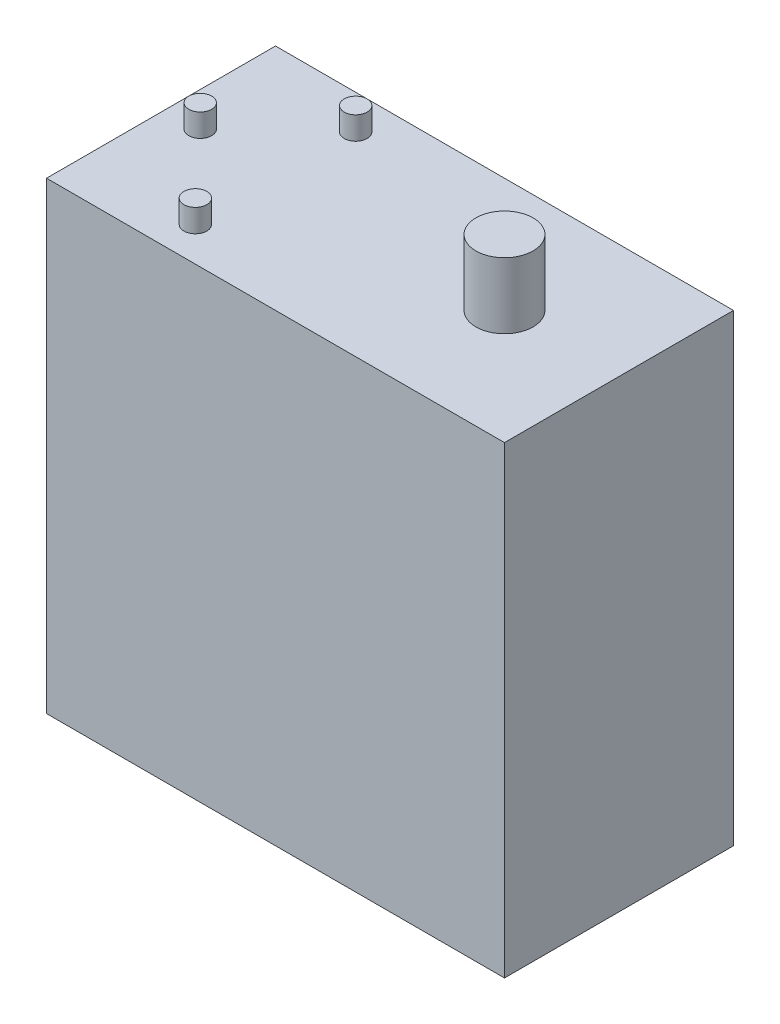
from build123d import *

# Parameters (mm, degrees)
SKETCH1_W                = 40
SKETCH1_H                = 20
BOSS_EXTRUDE1_DEPTH      = 40.5
BOSS_EXTRUDE2_DEPTH      = 5.75
BOSS_EXTRUDE2_DEPTH_BACK = 46.25
SKETCH2_R                = 2.5
BOSS_EXTRUDE3_DEPTH      = 2
BOSS_EXTRUDE3_DEPTH_BACK = 42.5
SKETCH3_R                = 1


with BuildPart() as part:
    # Sketch1 → Boss-Extrude1 (new body)
    with BuildSketch(Plane(origin=(0, 0, 0), x_dir=(1, 0, 0), z_dir=(0, 1, 0))):
        with Locations((3.756737992, 0.753901676)):
            Rectangle(SKETCH1_W, SKETCH1_H)
    extrude(amount=BOSS_EXTRUDE1_DEPTH)

    # Sketch2 → Boss-Extrude2 (add, two sides: drawn at the far end of the back side and taken through both)
    with BuildSketch(Plane(origin=(0, 40.5, 0), x_dir=(1, 0, 0), z_dir=(0, 1, 0)).offset(-BOSS_EXTRUDE2_DEPTH_BACK)):
        with Locations(Location((13.756737992, 0.753901676, 0), (0, 0, 270))):
            Circle(SKETCH2_R)
    extrude(amount=BOSS_EXTRUDE2_DEPTH + BOSS_EXTRUDE2_DEPTH_BACK)

    # Sketch3 → Boss-Extrude3 (add, two sides: drawn at the far end of the back side and taken through both)
    with BuildSketch(Plane(origin=(0, 40.5, 0), x_dir=(1, 0, 0), z_dir=(0, 1, 0)).offset(-BOSS_EXTRUDE3_DEPTH_BACK)):
        with Locations(Location((-13.243262008, 1.180776093, 0), (0, 0, 270))):
            Circle(SKETCH3_R)
        with Locations(Location((-6.243262008, 7.753901676, 0), (0, 0, 270))):
            Circle(SKETCH3_R)
        with Locations(Location((-6.243262008, -6.246098324, 0), (0, 0, 270))):
            Circle(SKETCH3_R)
    extrude(amount=BOSS_EXTRUDE3_DEPTH + BOSS_EXTRUDE3_DEPTH_BACK)


solid = part.part
